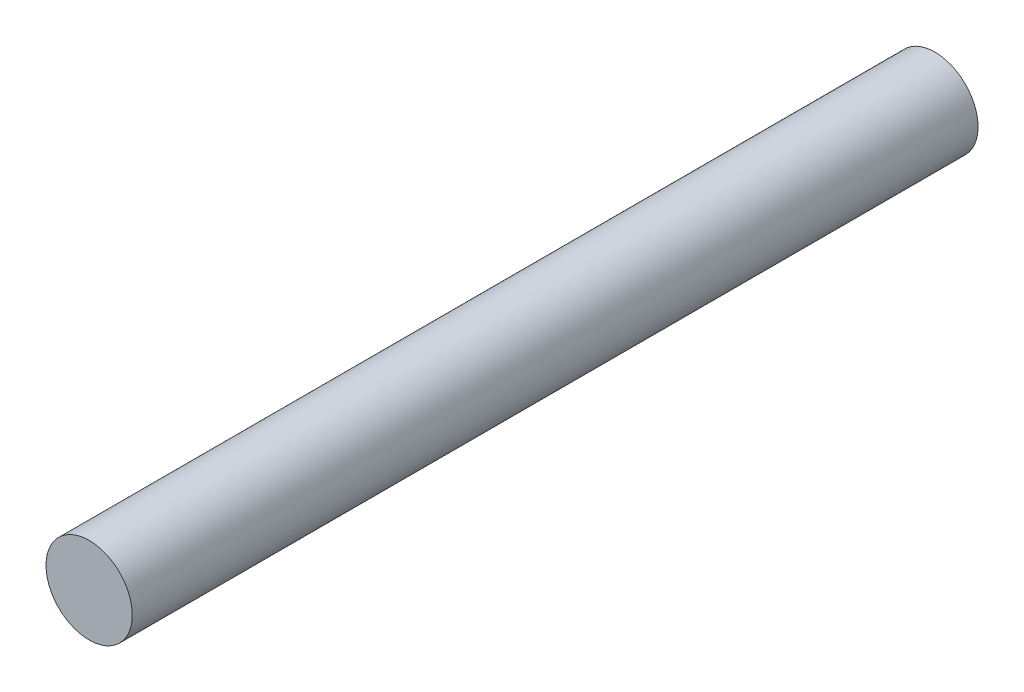
from build123d import *

# Parameters (mm, degrees)
SKETCH1_R                                       = 2.5
F_7_10_SAE_1010_BARRA_REDONDA_TREFILADO_5_DEPTH = 49


with BuildPart() as part:
    # Sketch1 → 7.10 sae 1010 barra redonda trefilado 5 MM(1) (new body)
    with BuildSketch(Plane(origin=(0, 0, 0), x_dir=(-1, 0, 0), z_dir=(0, 0, -1))):
        Circle(SKETCH1_R)
    extrude(amount=F_7_10_SAE_1010_BARRA_REDONDA_TREFILADO_5_DEPTH)


solid = part.part
